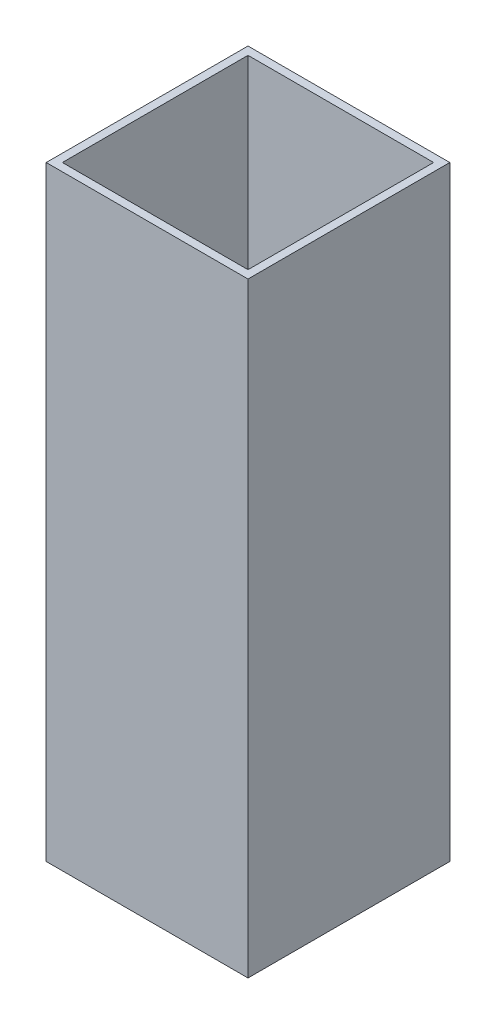
from build123d import *

# Parameters (mm, degrees)
SKETCH1_W           = 50
SKETCH1_H           = 50
SKETCH1_W_2         = 46
SKETCH1_H_2         = 46
BOSS_EXTRUDE1_DEPTH = 150


with BuildPart() as part:
    # Sketch1 → Boss-Extrude1 (new body)
    with BuildSketch(Plane(origin=(0, 0, 0), x_dir=(1, 0, 0), z_dir=(0, 1, 0))):
        Rectangle(SKETCH1_W, SKETCH1_H)
        Rectangle(SKETCH1_W_2, SKETCH1_H_2, mode=Mode.SUBTRACT)
    extrude(amount=BOSS_EXTRUDE1_DEPTH)


solid = part.part
